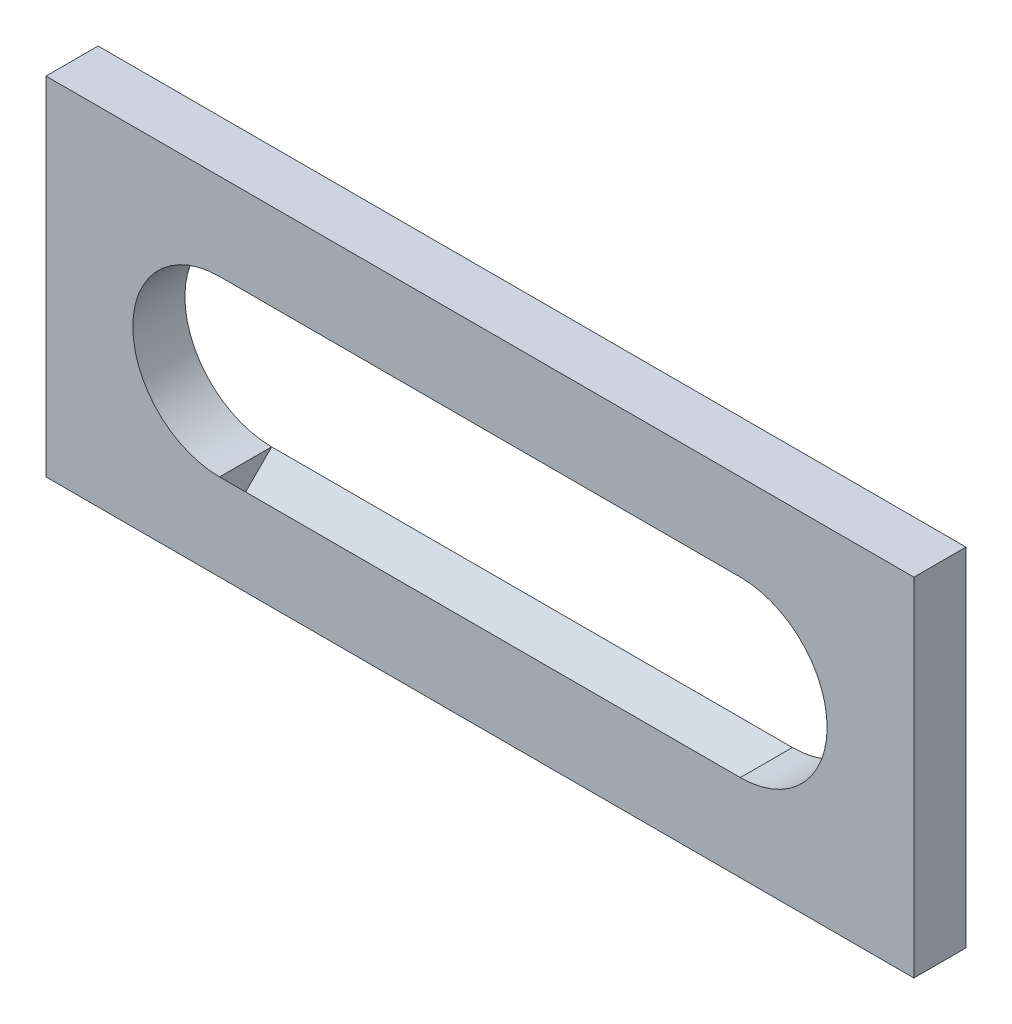
from build123d import *

# Parameters (mm, degrees)
SKETCH_1_W          = 50
SKETCH_1_H          = 20
EXTRUDE_3_DEPTH     = 3
SKETCH_2_R          = 5
SKETCH_2_W          = 30
SKETCH_2_H          = 10
CUT_EXTRUDE_1_DEPTH = 3
SKETCH_3_W          = 30
SKETCH_3_H          = 3
CUT_EXTRUDE_2_DEPTH = 1.5
EXTRUDE_4_REACH     = 43.34
SKETCH_5_W          = 30
SKETCH_5_H          = 3
CUT_EXTRUDE_3_DEPTH = 1.5
EXTRUDE_5_REACH     = 43.34


with BuildPart() as part:
    # 스케치1 → 보스-돌출3 (new body)
    with BuildSketch(Plane.XY):
        Rectangle(SKETCH_1_W, SKETCH_1_H)
    extrude(amount=EXTRUDE_3_DEPTH)

    # 스케치2 → 컷-돌출1 (cut)
    with BuildSketch(Plane.XY.offset(3)):
        with Locations((-15, 0)):
            Circle(SKETCH_2_R)
        with Locations((15, 0)):
            Circle(SKETCH_2_R)
        Rectangle(SKETCH_2_W, SKETCH_2_H)
    extrude(amount=-CUT_EXTRUDE_1_DEPTH, mode=Mode.SUBTRACT)

    # 스케치3 → 컷-돌출2 (cut)
    with BuildSketch(Plane.XZ.offset(-5)):
        with Locations((0, 1.5)):
            Rectangle(SKETCH_3_W, SKETCH_3_H)
    extrude(amount=-CUT_EXTRUDE_2_DEPTH, mode=Mode.SUBTRACT)

    # 스케치4 → 보스-돌출4 (add, up to next)
    with BuildSketch(Plane(origin=(-15, 0, 0), x_dir=(0, 0, -1), z_dir=(1, 0, 0)), mode=Mode.PRIVATE) as extrude_4_sk1:
        Polygon((-3, 6.5), (-3, 5), (-1.5, 6.5), align=None)
    extrude_4_tool1 = extrude(extrude_4_sk1.sketch, amount=EXTRUDE_4_REACH, mode=Mode.PRIVATE) - part.part
    # 스케치4 → 보스-돌출4 (add, up to next)
    with BuildSketch(Plane(origin=(-15, 0, 0), x_dir=(0, 0, -1), z_dir=(1, 0, 0)), mode=Mode.PRIVATE) as extrude_4_sk2:
        Polygon((0, 6.5), (-1.5, 6.5), (0, 5), align=None)
    extrude_4_tool2 = extrude(extrude_4_sk2.sketch, amount=EXTRUDE_4_REACH, mode=Mode.PRIVATE) - part.part
    add(extrude_4_tool1.solids().sort_by_distance((-15, 6, 2.5))[0])
    add(extrude_4_tool2.solids().sort_by_distance((-15, 6, 0.5))[0])

    # 스케치5 → 컷-돌출3 (cut)
    with BuildSketch(Plane(origin=(0, -5, 0), x_dir=(1, 0, 0), z_dir=(0, 1, 0))):
        with Locations((0, -1.5)):
            Rectangle(SKETCH_5_W, SKETCH_5_H)
    extrude(amount=-CUT_EXTRUDE_3_DEPTH, mode=Mode.SUBTRACT)

    # 스케치6 → 보스-돌출5 (add, up to next)
    with BuildSketch(Plane(origin=(-15, 0, 0), x_dir=(0, 0, -1), z_dir=(1, 0, 0)), mode=Mode.PRIVATE) as extrude_5_sk1:
        Polygon((-1.5, -6.5), (-3, -5), (-3, -6.5), align=None)
    extrude_5_tool1 = extrude(extrude_5_sk1.sketch, amount=EXTRUDE_5_REACH, mode=Mode.PRIVATE) - part.part
    # 스케치6 → 보스-돌출5 (add, up to next)
    with BuildSketch(Plane(origin=(-15, 0, 0), x_dir=(0, 0, -1), z_dir=(1, 0, 0)), mode=Mode.PRIVATE) as extrude_5_sk2:
        Polygon((0, -5), (-1.5, -6.5), (0, -6.5), align=None)
    extrude_5_tool2 = extrude(extrude_5_sk2.sketch, amount=EXTRUDE_5_REACH, mode=Mode.PRIVATE) - part.part
    add(extrude_5_tool1.solids().sort_by_distance((-15, -6, 2.5))[0])
    add(extrude_5_tool2.solids().sort_by_distance((-15, -6, 0.5))[0])


solid = part.part
